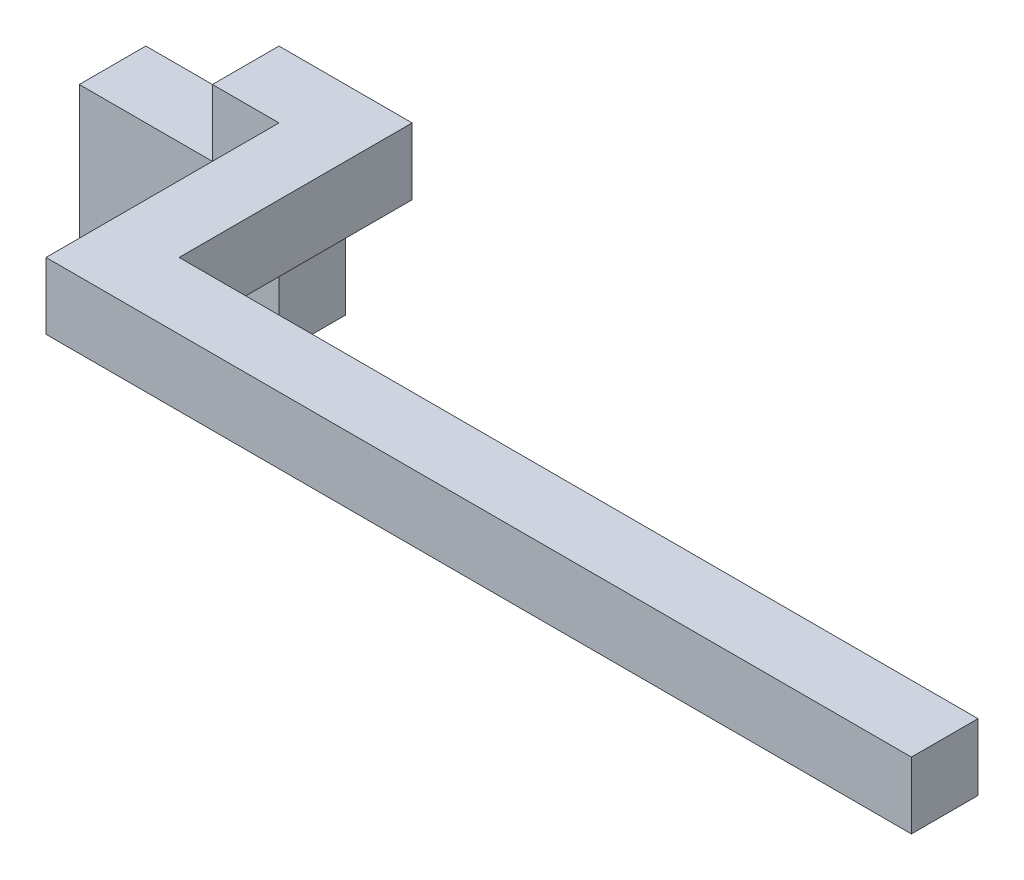
from build123d import *

# Parameters (mm, degrees)
SKETCH1_W           = 406.4
SKETCH1_H           = 76.2
BOSS_EXTRUDE1_DEPTH = 25.4
SKETCH2_W           = 330.2
SKETCH2_H           = 50.8
CUT_EXTRUDE1_DEPTH  = 336.04901134
SKETCH3_W           = 330.2
SKETCH3_H           = 25.4
BOSS_EXTRUDE2_DEPTH = 88.9
SKETCH4_W           = 50.8
SKETCH4_H           = 25.4
CUT_EXTRUDE2_DEPTH  = 346.710702756
SKETCH5_W           = 304.8
SKETCH5_H           = 88.9
CUT_EXTRUDE3_DEPTH  = 358.635247144
HOLE1_D             = 12.7
HOLE1_DEPTH         = 3.302


with BuildPart() as part:
    # Sketch1 → Boss-Extrude1 (new body)
    with BuildSketch(Plane.XY.offset(25.4)):
        with Locations((127, -12.7)):
            Rectangle(SKETCH1_W, SKETCH1_H)
    extrude(amount=-BOSS_EXTRUDE1_DEPTH)

    # Sketch2 → Cut-Extrude1 (cut, through all)
    with BuildSketch(Plane(origin=(0, 0, 0), x_dir=(-1, 0, 0), z_dir=(0, 0, -1))):
        with Locations((-165.1, -25.4)):
            Rectangle(SKETCH2_W, SKETCH2_H)
    extrude(amount=-CUT_EXTRUDE1_DEPTH, mode=Mode.SUBTRACT)

    # Sketch3 → Boss-Extrude2 (add)
    with BuildSketch(Plane.XY.offset(25.4)):
        with Locations((165.1, 12.7)):
            Rectangle(SKETCH3_W, SKETCH3_H)
    extrude(amount=BOSS_EXTRUDE2_DEPTH)

    # Sketch4 → Cut-Extrude2 (cut, through all)
    with BuildSketch(Plane.XY.offset(25.4)):
        with Locations((-50.8, 12.7)):
            Rectangle(SKETCH4_W, SKETCH4_H)
    extrude(amount=-CUT_EXTRUDE2_DEPTH, mode=Mode.SUBTRACT)

    # Sketch5 → Cut-Extrude3 (cut, through all)
    with BuildSketch(Plane(origin=(0, 25.4, 0), x_dir=(-1, 0, 0), z_dir=(0, 1, 0))):
        with Locations((-177.8, 44.45)):
            Rectangle(SKETCH5_W, SKETCH5_H)
    extrude(amount=-CUT_EXTRUDE3_DEPTH, mode=Mode.SUBTRACT)

    # Hole1
    with Locations(Plane(origin=(0, 0, 0), x_dir=(-1, 0, 0), z_dir=(0, 0, -1))):
        with Locations((-12.7, 12.7)):
            Hole(HOLE1_D / 2, depth=HOLE1_DEPTH)


solid = part.part
